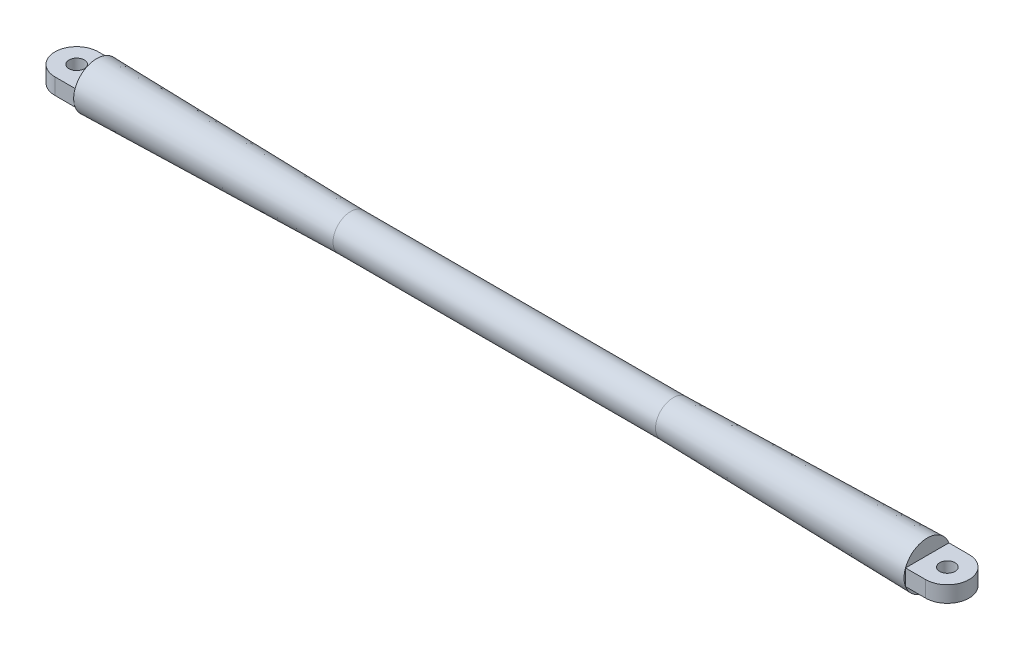
from build123d import *

# Parameters (mm, degrees)
SKETCH2_W          = 101.668203816
SKETCH2_H          = 68.038595239
CUT_EXTRUDE1_DEPTH = 95
CUT_EXTRUDE2_DEPTH = 155
SKETCH4_R          = 9.5
CUT_EXTRUDE3_DEPTH = 569.968860373


with BuildPart() as part:
    # Sketch1 → Revolve1 (revolve)
    with BuildSketch(Plane(origin=(0, 0, 0), x_dir=(1, 0, 0), z_dir=(0, 1, 0)), mode=Mode.PRIVATE) as revolve1_sk:
        Polygon((0, 0), (575, 0), (575, 30), (200, 22), (0, 22), align=None)
    revolve(revolve1_sk.sketch.rotate(Axis((0, 0, 0), (1, 0, 0)), 180), axis=Axis((0, 0, 0), (1, 0, 0)))

    # Sketch2 → Cut-Extrude1 (cut, symmetric)
    with BuildSketch(Plane.XY):
        with Locations((565.834101908, 44.01929762)):
            Rectangle(SKETCH2_W, SKETCH2_H)
        with Locations((565.834101908, -44.01929762)):
            Rectangle(SKETCH2_W, SKETCH2_H)
    extrude(amount=CUT_EXTRUDE1_DEPTH, both=True, mode=Mode.SUBTRACT)

    # Sketch3 → Cut-Extrude2 (cut, symmetric)
    with BuildSketch(Plane(origin=(0, 10, 0), x_dir=(1, 0, 0), z_dir=(0, 1, 0))):
        with BuildLine():
            Line((515, 26.922823032), (540, 26.922823032))
            ThreePointArc((540, 26.922823032), (566.922823032, 0), (540, -26.922823032))
            Line((540, -26.922823032), (515, -26.922823032))
            Line((515, -26.922823032), (515, -41.507616861))
            Line((515, -41.507616861), (582.660193307, -41.507616861))
            Line((582.660193307, -41.507616861), (582.660193307, 50.738358979))
            Line((582.660193307, 50.738358979), (515, 50.738358979))
            Line((515, 50.738358979), (515, 26.922823032))
        make_face()
    extrude(amount=CUT_EXTRUDE2_DEPTH, both=True, mode=Mode.SUBTRACT)

    # Sketch4 → Cut-Extrude3 (cut, through all)
    with BuildSketch(Plane(origin=(0, 10, 0), x_dir=(1, 0, 0), z_dir=(0, 1, 0))):
        with Locations(Location((540, 0, 0), (0, 0, 180))):
            Circle(SKETCH4_R)
    extrude(amount=-CUT_EXTRUDE3_DEPTH, mode=Mode.SUBTRACT)

    # Mirror1: part across plane


with BuildPart() as part_1:
    add(part.part)
    add(part.part.mirror(Plane(origin=(0, 0, -22), x_dir=(0, 0, 1), z_dir=(1, 0, 0))))


solid = part_1.part
